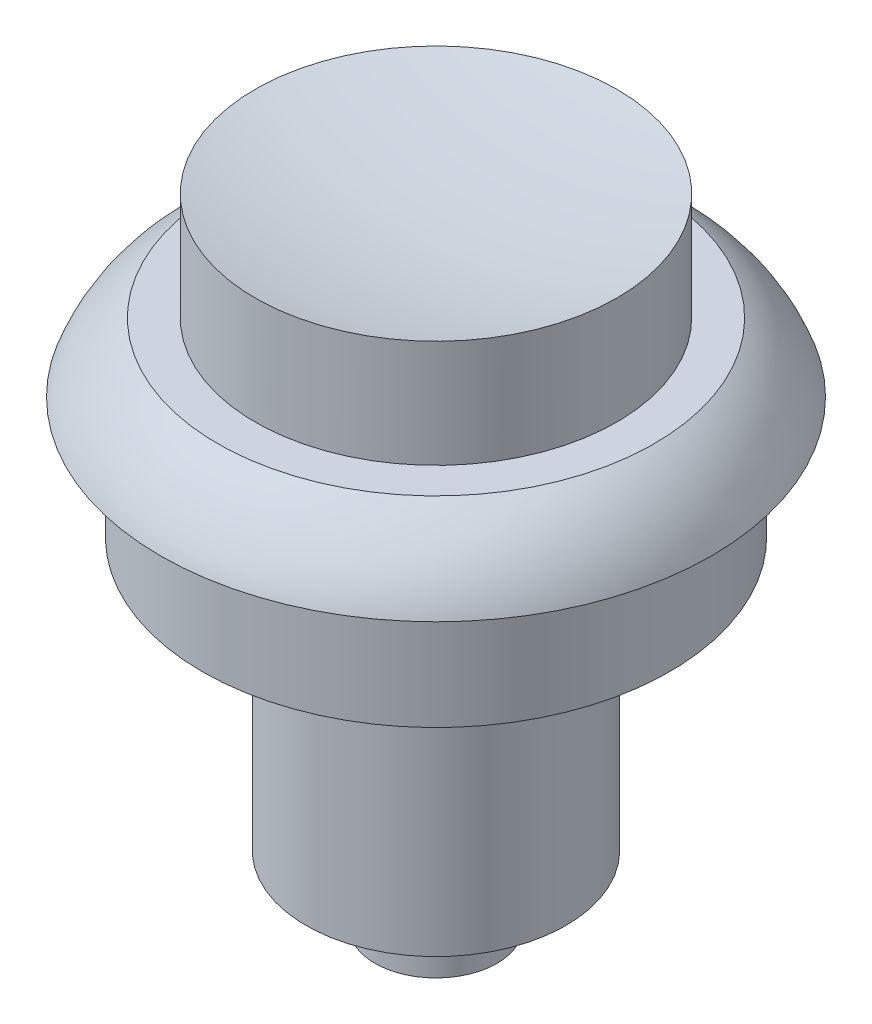
from build123d import *

# Parameters (mm, degrees)
SKETCH2_R          = 1.905
CUT_EXTRUDE1_DEPTH = 3.3782


with BuildPart() as part:
    # Sketch1 → Revolve1 (revolve)
    with BuildSketch(Plane.XY, mode=Mode.PRIVATE) as revolve1_sk:
        with BuildLine():
            Line((0, 0), (0, 37.592))
            ThreePointArc((0, 37.592), (5.560874504, 37.910541815), (11.049, 38.862))
            Line((11.049, 38.862), (11.049, 32.2961))
            Line((11.049, 32.2961), (13.335, 32.2961))
            ThreePointArc((13.335, 32.2961), (15.452618981, 30.510074151), (16.8275, 28.1051))
            Line((16.8275, 28.1051), (14.2875, 28.1051))
            Line((14.2875, 28.1051), (14.2875, 20.7137))
            Line((14.2875, 20.7137), (7.9375, 20.7137))
            Line((7.9375, 20.7137), (7.9375, 4.1021))
            Line((7.9375, 4.1021), (3.7338, 4.1021))
            Line((3.7338, 4.1021), (3.7338, 0))
            Line((3.7338, 0), (0, 0))
        make_face()
    revolve(revolve1_sk.sketch.rotate(Axis((0, 0, 0), (0, 1, 0)), 90), axis=Axis((0, 0, 0), (0, 1, 0)))

    # Sketch2 → Cut-Extrude1 (cut)
    with BuildSketch(Plane.XZ):
        with Locations(Location((0, 0, 0), (0, 0, 270))):
            Circle(SKETCH2_R)
    extrude(amount=-CUT_EXTRUDE1_DEPTH, mode=Mode.SUBTRACT)


solid = part.part
